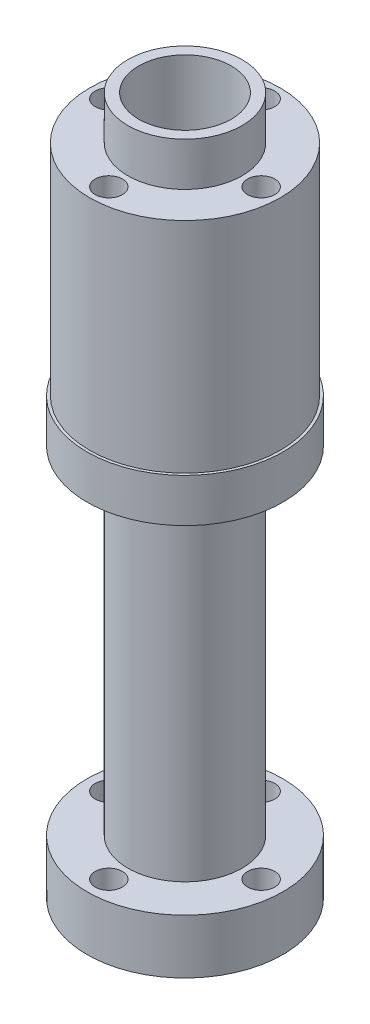
from build123d import *

# Parameters (mm, degrees)
SKETCH_2_R          = 1.25
CUT_EXTRUDE_1_DEPTH = 10
CUT_EXTRUDE_START   = -54.1
SKETCH_2_2_R        = 1.25
CUT_EXTRUDE_2_DEPTH = 6
SKETCH_3_OUTSIDE_W  = 33.054
SKETCH_3_OUTSIDE_H  = 33.054
SKETCH_3_OUTSIDE_R  = 8.75
CUT_EXTRUDE_3_DEPTH = 20.1
SKETCH_4_R          = 5.25
SKETCH_4_R_2        = 4.25
EXTRUDE_1_DEPTH     = 4


with BuildPart() as part:
    # 草图1 → 旋转1 (revolve)
    with BuildSketch(Plane.XY, mode=Mode.PRIVATE) as revolve_1_sk:
        Polygon((-9, 36), (-5.25, 36), (-5.25, 5), (-9, 5), (-9, 0), (-4.25, 0), (-4.25, 60.1), (-9, 60.1), align=None)
    revolve(revolve_1_sk.sketch.rotate(Axis((0, 0, 0), (0, 1, 0)), 270), axis=Axis((0, 0, 0), (0, 1, 0)))

    # 草图2 → 切除-拉伸1 (cut)
    with BuildSketch(Plane(origin=(0, 60.1, 0), x_dir=(1, 0, 0), z_dir=(0, 1, 0))):
        with Locations(Location((0, 7, 0), (0, 0, 270))):
            Circle(SKETCH_2_R)
        with Locations(Location((0, -7, 0), (0, 0, 270))):
            Circle(SKETCH_2_R)
        with Locations(Location((-7, 0, 0), (0, 0, 270))):
            Circle(SKETCH_2_R)
        with Locations(Location((7, 0, 0), (0, 0, 270))):
            Circle(SKETCH_2_R)
    extrude(amount=-CUT_EXTRUDE_1_DEPTH, mode=Mode.SUBTRACT)

    # 草图2<2> → 切除-拉伸2 (cut)
    with BuildSketch(Plane(origin=(0, 60.1, 0), x_dir=(1, 0, 0), z_dir=(0, 1, 0)).offset(CUT_EXTRUDE_START)):
        with Locations(Location((0, 7, 0), (0, 0, 270))):
            Circle(SKETCH_2_2_R)
        with Locations(Location((0, -7, 0), (0, 0, 270))):
            Circle(SKETCH_2_2_R)
        with Locations(Location((-7, 0, 0), (0, 0, 270))):
            Circle(SKETCH_2_2_R)
        with Locations(Location((7, 0, 0), (0, 0, 270))):
            Circle(SKETCH_2_2_R)
    extrude(amount=-CUT_EXTRUDE_2_DEPTH, mode=Mode.SUBTRACT)

    # 草图3 outside → 切除-拉伸3 (cut)
    with BuildSketch(Plane(origin=(0, 60.1, 0), x_dir=(1, 0, 0), z_dir=(0, 1, 0))):
        Rectangle(SKETCH_3_OUTSIDE_W, SKETCH_3_OUTSIDE_H)
        with Locations(Location((0, 0, 0), (0, 0, 270))):
            Circle(SKETCH_3_OUTSIDE_R, mode=Mode.SUBTRACT)
    extrude(amount=-CUT_EXTRUDE_3_DEPTH, mode=Mode.SUBTRACT)

    # 草图4 → 凸台-拉伸1 (add)
    with BuildSketch(Plane(origin=(0, 60.1, 0), x_dir=(1, 0, 0), z_dir=(0, 1, 0))):
        with Locations(Location((0, 0, 0), (0, 0, 90))):
            Circle(SKETCH_4_R)
        with Locations(Location((0, 0, 0), (0, 0, 90))):
            Circle(SKETCH_4_R_2, mode=Mode.SUBTRACT)
    extrude(amount=EXTRUDE_1_DEPTH)


solid = part.part
